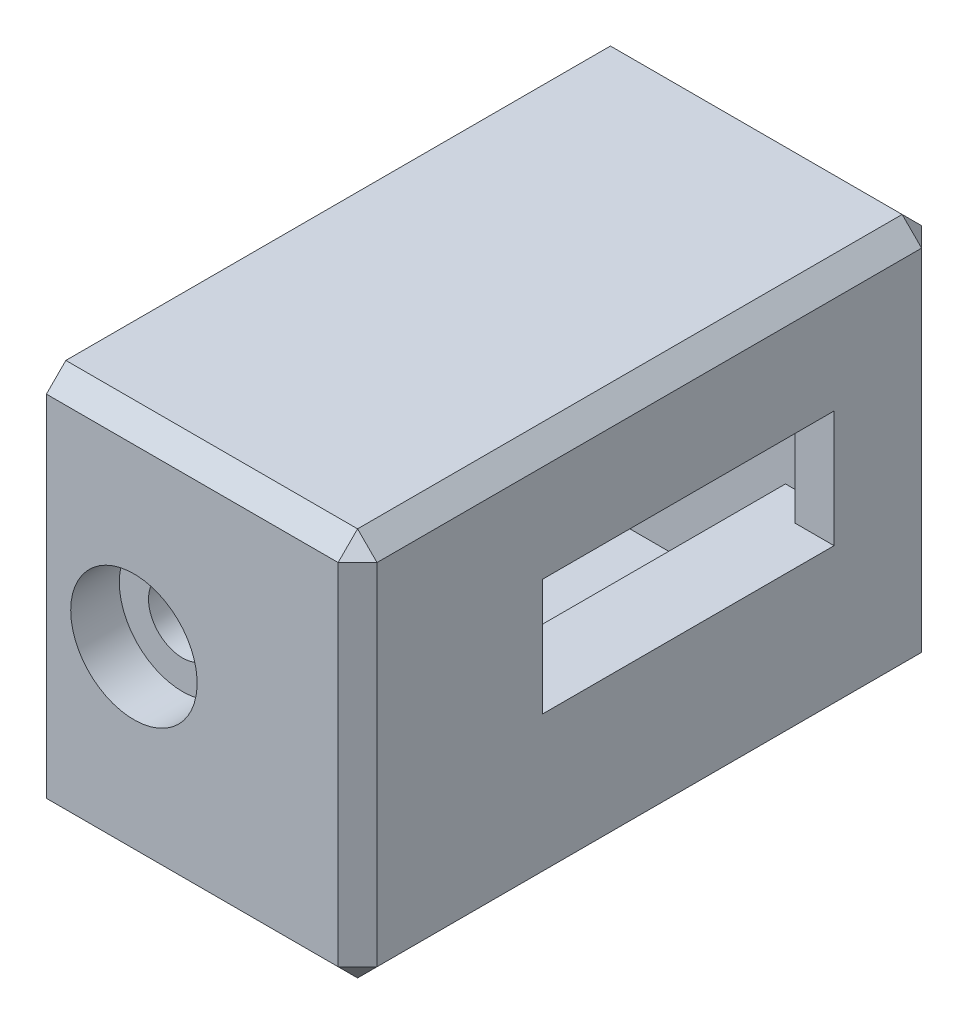
from build123d import *

# Parameters (mm, degrees)
SKETCH1_W           = 16
SKETCH1_H           = 20
BOSS_EXTRUDE1_DEPTH = 15
SHELL1_T            = -2
SKETCH10_W          = 2
SKETCH10_H          = 16
BOSS_EXTRUDE4_DEPTH = 14
CUT_EXTRUDE2_REACH  = 32.726
SKETCH3_W           = 15
SKETCH3_H           = 6
CHAMFER1_SIZE       = 1
SKETCH4_W           = 4
SKETCH4_H           = 4
SKETCH4_W_2         = 22
SKETCH4_H_2         = 1.5
BOSS_EXTRUDE2_DEPTH = 2
CUT_EXTRUDE3_REACH  = 28.249
SKETCH5_W           = 12
SKETCH5_H           = 11.5
SKETCH8_R           = 1.75
CUT_EXTRUDE5_DEPTH  = 33.619012861
SKETCH9_R           = 3.25
CUT_EXTRUDE6_DEPTH  = 2.5


with BuildPart() as part:
    # Sketch1 → Boss-Extrude1 (new, symmetric)
    with BuildSketch(Plane.XY):
        Rectangle(SKETCH1_W, SKETCH1_H)
    extrude(amount=BOSS_EXTRUDE1_DEPTH, both=True)

    # Shell1
    shell1_openings = [part.faces().sort_by_distance(p)[0] for p in [
        (-8, 0, 0),
    ]]
    offset(amount=SHELL1_T, openings=shell1_openings, kind=Kind.INTERSECTION)

    # Sketch10 → Boss-Extrude4 (add)
    with BuildSketch(Plane.ZY.offset(-6)):
        with Locations((-12, 0)):
            Rectangle(SKETCH10_W, SKETCH10_H)
        with Locations((12, 0)):
            Rectangle(SKETCH10_W, SKETCH10_H)
    extrude(amount=BOSS_EXTRUDE4_DEPTH)

    # Sketch3 → Cut-Extrude2 (cut, up to next)
    with BuildSketch(Plane(origin=(8, 0, 9.25), x_dir=(0, 0, 1), z_dir=(-1, 0, 0)), mode=Mode.PRIVATE) as cut_extrude2_sk1:
        with Locations((-11.25, 1)):
            Rectangle(SKETCH3_W, SKETCH3_H)
    cut_extrude2_tool1 = extrude(cut_extrude2_sk1.sketch, amount=CUT_EXTRUDE2_REACH, mode=Mode.PRIVATE) & part.part
    add(cut_extrude2_tool1.solids().sort_by_distance((8, 1, -2))[0], mode=Mode.SUBTRACT)

    # Chamfer1
    chamfer1_edges = [part.edges().sort_by_distance(p)[0] for p in [
        (0, -10, 15),
        (8, 0, 15),
        (0, -10, -15),
        (0, 10, -15),
        (8, 0, -15),
        (0, 10, 15),
        (8, -10, 0),
        (8, 10, 0),
    ]]
    chamfer(chamfer1_edges, length=CHAMFER1_SIZE)

    # Sketch4 → Boss-Extrude2 (add)
    with BuildSketch(Plane.ZY.offset(-6)):
        with Locations((-9, 6)):
            Rectangle(SKETCH4_W, SKETCH4_H)
        with Locations((9, 6)):
            Rectangle(SKETCH4_W, SKETCH4_H)
        with Locations((0, -2.75)):
            Rectangle(SKETCH4_W_2, SKETCH4_H_2)
    extrude(amount=BOSS_EXTRUDE2_DEPTH)

    # Sketch5 → Cut-Extrude3 (cut, up to next)
    with BuildSketch(Plane.XZ.offset(10), mode=Mode.PRIVATE) as cut_extrude3_sk1:
        with Locations((-2, 5.25)):
            Rectangle(SKETCH5_W, SKETCH5_H)
    cut_extrude3_tool1 = extrude(cut_extrude3_sk1.sketch, amount=-CUT_EXTRUDE3_REACH, mode=Mode.PRIVATE) & part.part
    add(cut_extrude3_tool1.solids().sort_by_distance((-2, -10, 5.25))[0], mode=Mode.SUBTRACT)

    # Sketch8 → Cut-Extrude5 (cut, through all)
    with BuildSketch(Plane(origin=(0, 0, -15), x_dir=(-1, 0, 0), z_dir=(0, 0, -1))):
        with Locations((3.5, 0)):
            Circle(SKETCH8_R)
    extrude(amount=-CUT_EXTRUDE5_DEPTH, mode=Mode.SUBTRACT)

    # Sketch9 → Cut-Extrude6 (cut)
    with BuildSketch(Plane(origin=(0, 0, -15), x_dir=(-1, 0, 0), z_dir=(0, 0, -1))):
        with Locations((3.5, 0)):
            Circle(SKETCH9_R)
    cut_extrude6 = extrude(amount=-CUT_EXTRUDE6_DEPTH, mode=Mode.SUBTRACT)

    # Mirror1: Cut-Extrude6 across plane
    add(cut_extrude6.mirror(Plane.XY), mode=Mode.SUBTRACT)


solid = part.part
